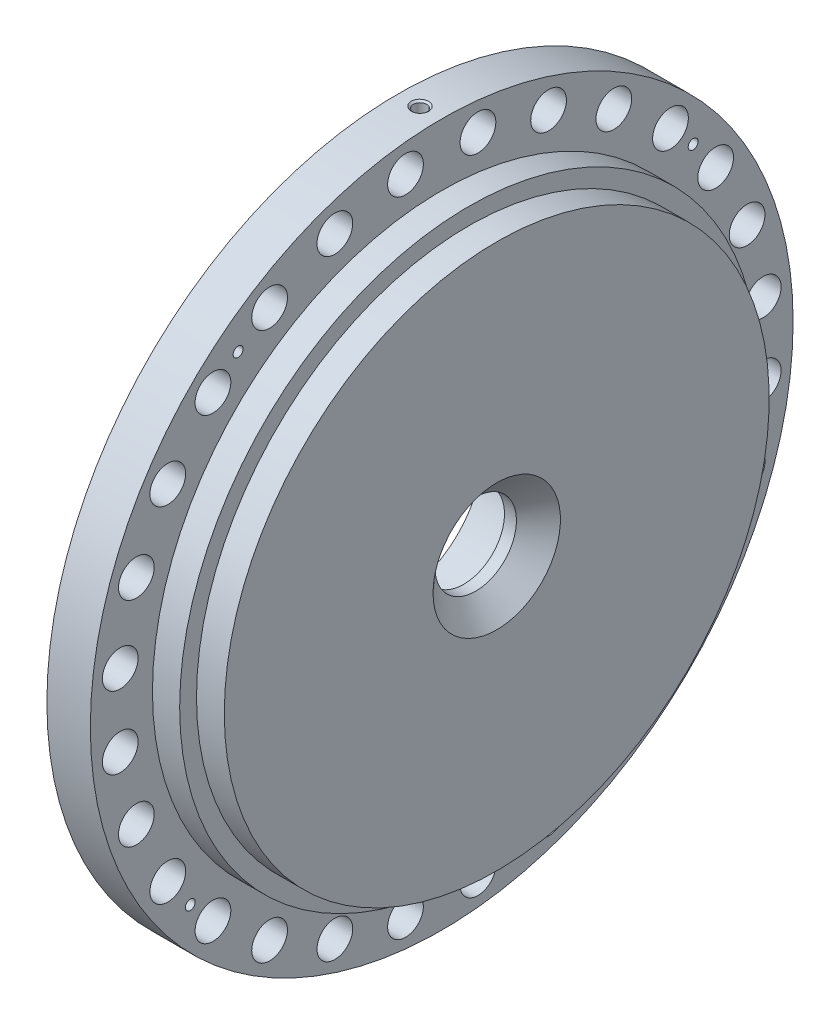
from build123d import *

# Parameters (mm, degrees)
SKETCH4_R                         = 14.2875
CUT_EXTRUDE1_DEPTH                = 406.190469782
CIRPATTERN2_COUNT                 = 28
CIRPATTERN3_COUNT                 = 12
CIRPATTERN4_COUNT                 = 4
CIRPATTERN5_COUNT                 = 4
F_1_2_13_TAPPED_HOLE4_D           = 10.71626
F_1_2_13_TAPPED_HOLE4_DEPTH       = 35.052
F_1_2_13_TAPPED_HOLE4_CSINK_D     = 13.97
F_1_2_13_TAPPED_HOLE4_CSINK_ANGLE = 100
F_1_2_13_TAPPED_HOLE4_TIP         = 3.219489309


with BuildPart() as part:
    # Sketch1 → Revolve1 (revolve)
    with BuildSketch(Plane.XY, mode=Mode.PRIVATE) as revolve1_sk:
        Polygon((-5.9944, 67.5005), (-5.9944, 180.9496), (0, 180.9496), (0, 228.9937), (-5.9944, 228.9937), (-5.9944, 281.051), (28.7528, 281.051), (28.7528, 231.3686), (50.5206, 231.3686), (50.5206, 217.9066), (72.7456, 217.9066), (72.7456, 50.9524), (55.9308, 32.5628), (46.4058, 32.5628), (46.4058, 67.5005), align=None)
    revolve(revolve1_sk.sketch.rotate(Axis((0, 0, 0), (1, 0, 0)), 90), axis=Axis((0, 0, 0), (1, 0, 0)))

    # Sketch4 → Cut-Extrude1 (cut, through all)
    with BuildSketch(Plane.ZY.offset(5.9944)):
        with Locations((28.972111579, 257.135466548)):
            Circle(SKETCH4_R)
    cut_extrude1 = extrude(amount=-CUT_EXTRUDE1_DEPTH, mode=Mode.SUBTRACT)

    # CirPattern2: Cut-Extrude1 ×28 about axis
    cirpattern2_axis = Axis((0, 0, 0), (1, 0, 0))
    for i in range(1, CIRPATTERN2_COUNT):
        add(cut_extrude1.rotate(cirpattern2_axis, i * 360 / CIRPATTERN2_COUNT), mode=Mode.SUBTRACT)

    # Sketch8 → 3/4-10 Tapped Hole1 (revolve, cut)
    with BuildSketch(Plane(origin=(0, 121.949427599, 166.490173083), x_dir=(0, 0, 1), z_dir=(0, 1, 0))):
        Polygon((0, 0), (0, 30.407416175), (8.33374, 25.4), (8.33374, 1.82626), (10.16, 0), align=None)
    f_3_4_10_tapped_hole1 = revolve(axis=Axis((-6.35, 121.949427599, 166.490173083), (1, 0, 0)), mode=Mode.SUBTRACT)

    # CirPattern3: 3/4-10 Tapped Hole1 ×12 about axis
    cirpattern3_axis = Axis((0, 0, 0), (1, 0, 0))
    for i in range(1, CIRPATTERN3_COUNT):
        add(f_3_4_10_tapped_hole1.rotate(cirpattern3_axis, i * 360 / CIRPATTERN3_COUNT), mode=Mode.SUBTRACT)

    # Sketch10 → 7/8-9 Tapped Hole1 (revolve, cut)
    with BuildSketch(Plane(origin=(-5.9944, 67.172315786, 67.172315786), x_dir=(0, 0, 1), z_dir=(0, 1, 0))):
        Polygon((0, 0), (0, 31.242239902), (9.72312, 25.4), (9.72312, 2.02438), (11.7475, 0), align=None)
    f_7_8_9_tapped_hole1 = revolve(axis=Axis((-12.3444, 67.172315786, 67.172315786), (1, 0, 0)), mode=Mode.SUBTRACT)

    # CirPattern4: 7/8-9 Tapped Hole1 ×4 about axis
    cirpattern4_axis = Axis((0, 0, 0), (1, 0, 0))
    for i in range(1, CIRPATTERN4_COUNT):
        add(f_7_8_9_tapped_hole1.rotate(cirpattern4_axis, i * 360 / CIRPATTERN4_COUNT), mode=Mode.SUBTRACT)

    # Sketch12 → Tap Drill for 3/8-16 Tap1 (revolve, cut)
    with BuildSketch(Plane(origin=(-5.9944, -162.844517689, 201.096231852), x_dir=(0, 0, 1), z_dir=(0, 1, 0))):
        Polygon((0, 0), (0, 43.024665582), (3.96875, 40.64), (3.96875, 0.635), (4.60375, 0), align=None)
    tap_drill_for_3_8_16_tap1 = revolve(axis=Axis((-12.3444, -162.844517689, 201.096231852), (1, 0, 0)), mode=Mode.SUBTRACT)

    # CirPattern5: Tap Drill for 3/8-16 Tap1 ×4 about axis
    cirpattern5_axis = Axis((0, 0, 0), (1, 0, 0))
    for i in range(1, CIRPATTERN5_COUNT):
        add(tap_drill_for_3_8_16_tap1.rotate(cirpattern5_axis, i * 360 / CIRPATTERN5_COUNT), mode=Mode.SUBTRACT)

    # 1/2-13 Tapped Hole4
    with Locations(Plane(origin=(11.3792, 281.051, 0), x_dir=(0, 0, 1), z_dir=(0, 1, 0))):
        with Locations((0, 0)):
            CounterSinkHole(F_1_2_13_TAPPED_HOLE4_D / 2, F_1_2_13_TAPPED_HOLE4_CSINK_D / 2, depth=F_1_2_13_TAPPED_HOLE4_DEPTH, counter_sink_angle=F_1_2_13_TAPPED_HOLE4_CSINK_ANGLE)
            with Locations((0, 0, -(F_1_2_13_TAPPED_HOLE4_DEPTH + F_1_2_13_TAPPED_HOLE4_TIP / 2))):  # 118° drill point
                Cone(0, F_1_2_13_TAPPED_HOLE4_D / 2, F_1_2_13_TAPPED_HOLE4_TIP, mode=Mode.SUBTRACT)


solid = part.part
